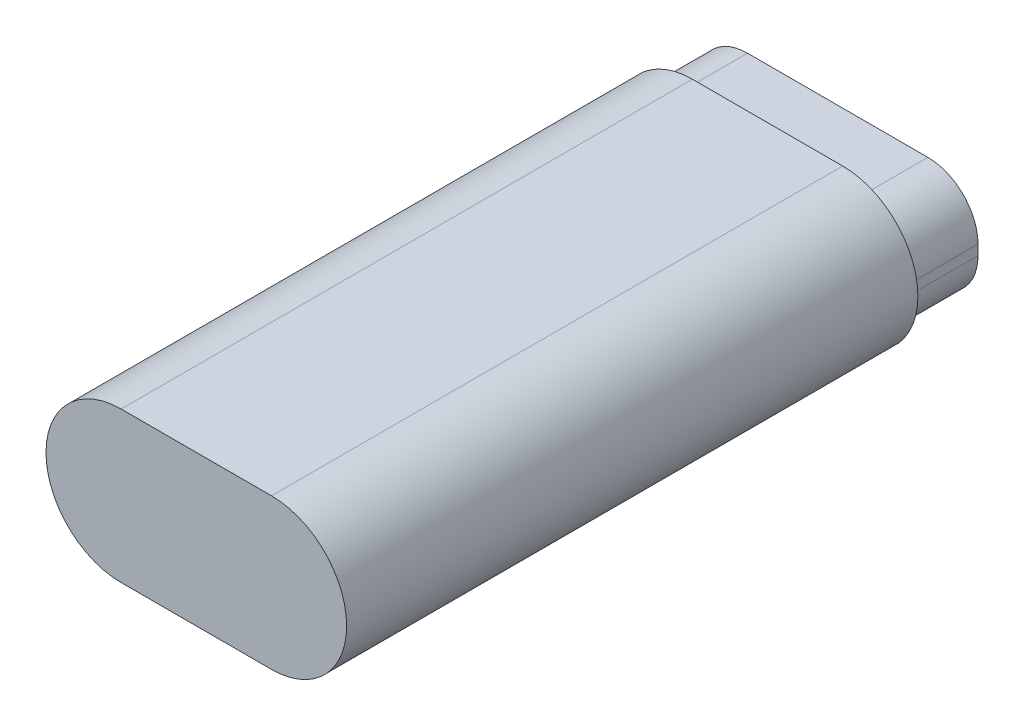
from build123d import *

# Parameters (mm, degrees)
BOSS_EXTRUDE1_DEPTH = 57
BOSS_EXTRUDE2_DEPTH = 7


with BuildPart() as part:
    # Sketch1 → Boss-Extrude1 (new body)
    with BuildSketch(Plane.XY):
        with BuildLine():
            Line((0, 7.5), (15, 7.5))
            ThreePointArc((15, 7.5), (22.5, 0), (15, -7.5))
            Line((15, -7.5), (0, -7.5))
            ThreePointArc((0, -7.5), (-7.5, 0), (0, 7.5))
        make_face()
    extrude(amount=BOSS_EXTRUDE1_DEPTH)

    # Sketch3 → Boss-Extrude2 (add)
    with BuildSketch(Plane(origin=(0, 0, 0), x_dir=(-1, 0, 0), z_dir=(0, 0, -1))):
        with BuildLine():
            Line((-16.5, 5.5), (1.5, 5.5))
            ThreePointArc((1.5, 5.5), (5.035533906, 4.035533906), (6.5, 0.5))
            Line((6.5, 0.5), (6.5, -0.5))
            ThreePointArc((6.5, -0.5), (5.035533906, -4.035533906), (1.5, -5.5))
            Line((1.5, -5.5), (-16.5, -5.5))
            ThreePointArc((-16.5, -5.5), (-20.035533906, -4.035533906), (-21.5, -0.5))
            Line((-21.5, -0.5), (-21.5, 0.5))
            ThreePointArc((-21.5, 0.5), (-20.035533906, 4.035533906), (-16.5, 5.5))
        make_face()
    extrude(amount=BOSS_EXTRUDE2_DEPTH)


solid = part.part
